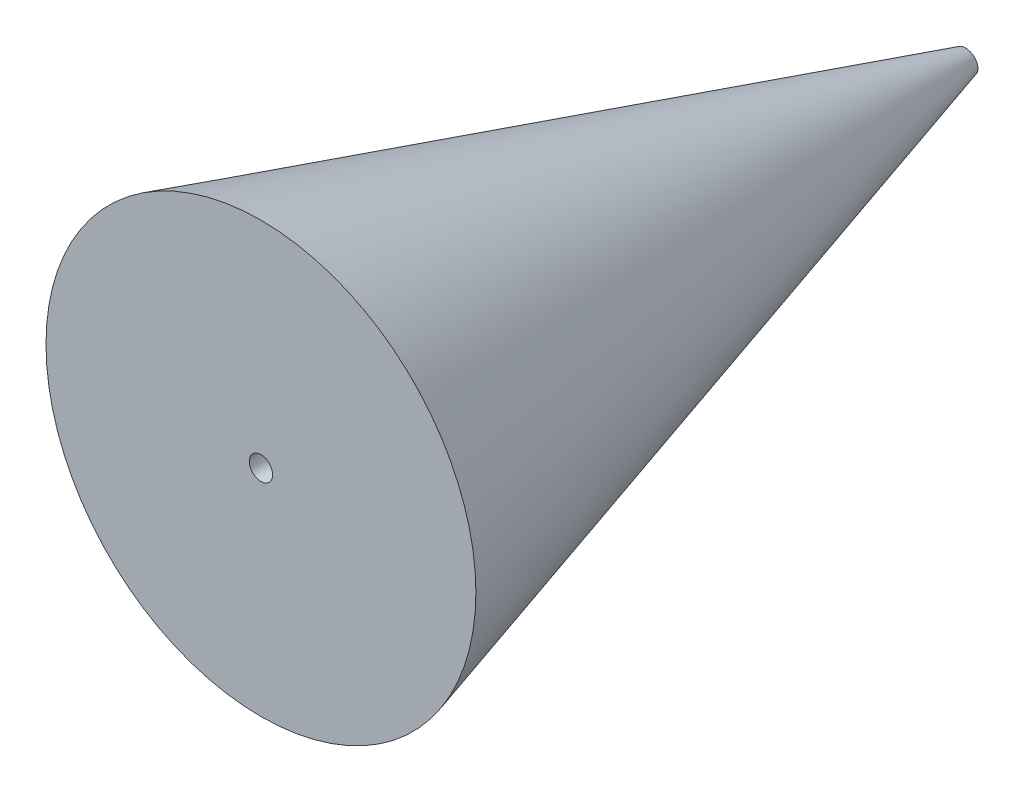
from build123d import *

# Parameters (mm, degrees)
CUT_EXTRUDE1_DEPTH      = 220.435755361
CUT_EXTRUDE1_DEPTH_BACK = 203.2
SKETCH1_R               = 3.175


with BuildPart() as part:
    # Sketch2 → Revolve1 (revolve)
    with BuildSketch(Plane(origin=(0, 0, 0), x_dir=(1, 0, 0), z_dir=(0, 1, 0))):
        Polygon((0.017211825, 0), (0.017211825, 203.2), (58.582536047, 0), align=None)
    revolve(axis=Axis((0.017211825, 0, 0), (0, 0, -1)))

    # Sketch1 → Cut-Extrude1 (cut, two sides: drawn at the far end of the back side and taken through both)
    with BuildSketch(Plane.XY.offset(-CUT_EXTRUDE1_DEPTH_BACK)):
        with Locations(Location((0.017211825, 0.068964518, 0), (0, 0, 228.659791567))):
            Circle(SKETCH1_R)
    extrude(amount=CUT_EXTRUDE1_DEPTH + CUT_EXTRUDE1_DEPTH_BACK, mode=Mode.SUBTRACT)


solid = part.part
